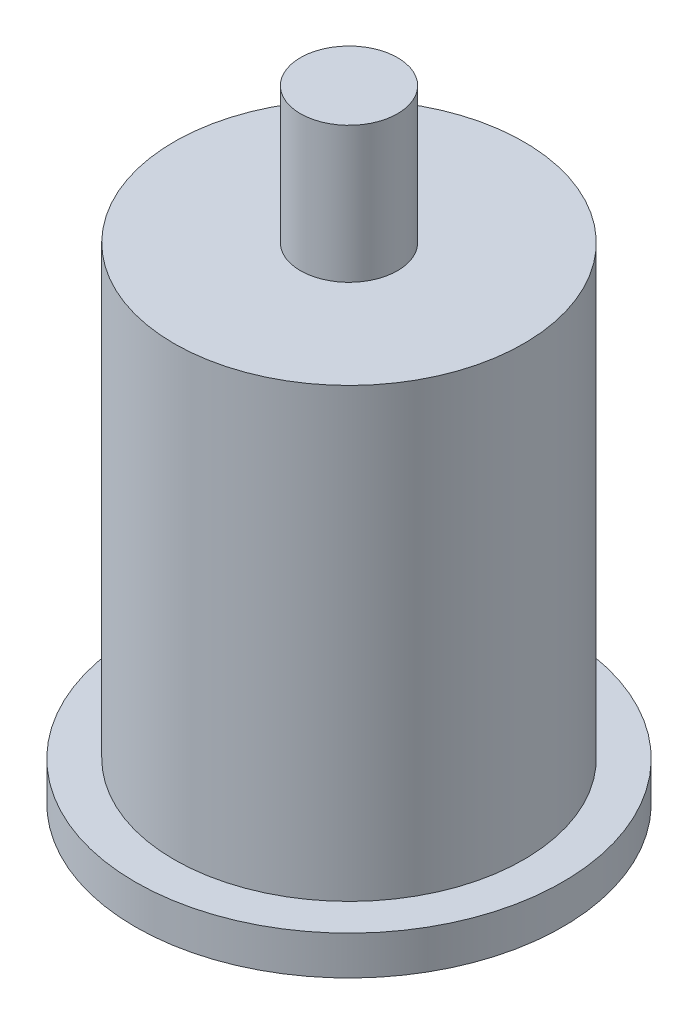
from build123d import *

# Parameters (mm, degrees)
SKETCH1_R           = 11
BOSS_EXTRUDE1_DEPTH = 2
SKETCH2_R           = 9
BOSS_EXTRUDE2_DEPTH = 23
SKETCH3_R           = 2.5
BOSS_EXTRUDE3_DEPTH = 7


with BuildPart() as part:
    # Sketch1 → Boss-Extrude1 (new body)
    with BuildSketch(Plane(origin=(0, -139.5, 0), x_dir=(1, 0, 0), z_dir=(0, 1, 0))):
        with Locations(Location((15, -26, 0), (0, 0, 270))):
            Circle(SKETCH1_R)
    extrude(amount=BOSS_EXTRUDE1_DEPTH)

    # Sketch2 → Boss-Extrude2 (add)
    with BuildSketch(Plane(origin=(0, -137.5, 0), x_dir=(1, 0, 0), z_dir=(0, 1, 0))):
        with Locations(Location((15, -26, 0), (0, 0, 270))):
            Circle(SKETCH2_R)
    extrude(amount=BOSS_EXTRUDE2_DEPTH)

    # Sketch3 → Boss-Extrude3 (add)
    with BuildSketch(Plane(origin=(0, -114.5, 0), x_dir=(1, 0, 0), z_dir=(0, 1, 0))):
        with Locations(Location((15, -26, 0), (0, 0, 270))):
            Circle(SKETCH3_R)
    extrude(amount=BOSS_EXTRUDE3_DEPTH)


solid = part.part
